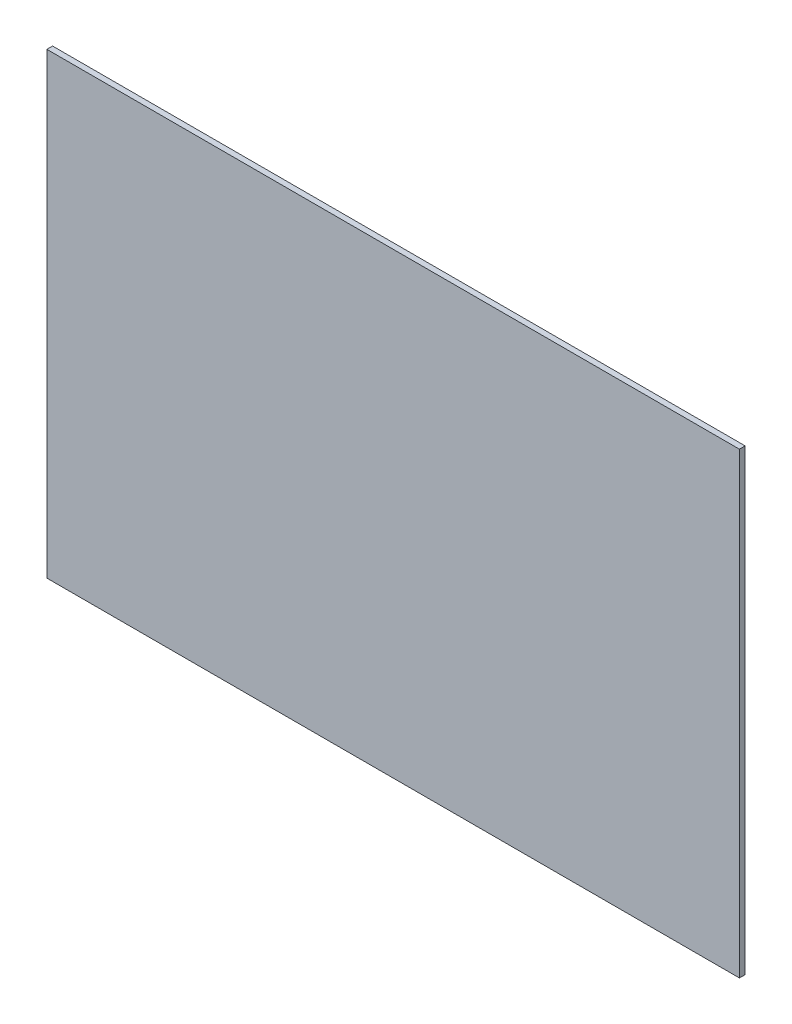
from build123d import *

# Parameters (mm, degrees)
SKETCH1_W           = 604.95
SKETCH1_H           = 400
BOSS_EXTRUDE1_DEPTH = 5


with BuildPart() as part:
    # Sketch1 → Boss-Extrude1 (new body)
    with BuildSketch(Plane.XY):
        Rectangle(SKETCH1_W, SKETCH1_H)
    extrude(amount=BOSS_EXTRUDE1_DEPTH)


solid = part.part
